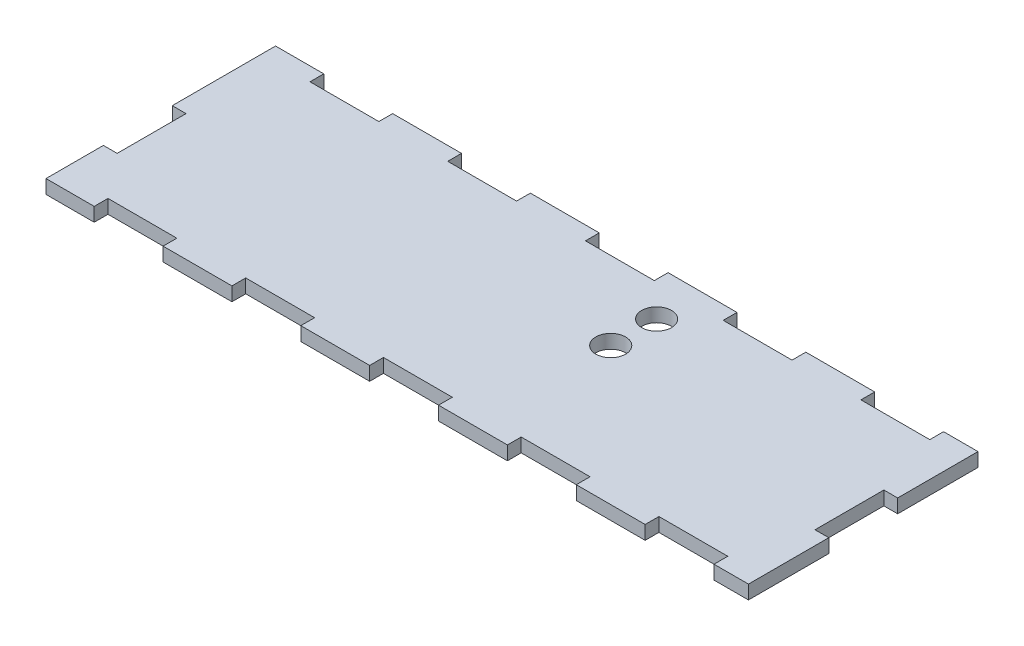
from build123d import *

# Parameters (mm, degrees)
CROQUIS1_R              = 3.25
SALIENTE_EXTRUIR1_DEPTH = 3


with BuildPart() as part:
    # Croquis1 → Saliente-Extruir1 (new body)
    with BuildSketch(Plane(origin=(0, 0, 0), x_dir=(1, 0, 0), z_dir=(0, 1, 0))):
        Polygon((0, 12.5), (0, 0), (10.5, 0), (10.5, 3), (25.5, 3), (25.5, 0), (40.5, 0), (40.5, 3), (55.5, 3), (55.5, 0), (70.5, 0), (70.5, 3), (85.5, 3), (85.5, 0), (100.5, 0), (100.5, 3), (115.5, 3), (115.5, 0), (130.5, 0), (130.5, 3), (145.5, 3), (145.5, 0), (153, 0), (153, 17.5), (150, 17.5), (150, 25), (150, 32.5), (153, 32.5), (153, 50), (145.5, 50), (145.5, 47), (130.5, 47), (130.5, 50), (115.5, 50), (115.5, 47), (100.5, 47), (100.5, 50), (93, 50), (85.5, 50), (85.5, 47), (70.5, 47), (70.5, 50), (67.60876348, 50), (55.5, 50), (55.5, 47), (40.5, 47), (40.5, 50), (25.5, 50), (25.5, 47), (10.5, 47), (10.5, 50), (3, 50), (0, 50), (0, 40), (0, 27.5), (3, 27.5), (3, 20), (3, 12.5), align=None)
        with Locations(Location((93, 30, 0), (0, 0, 270))):
            Circle(CROQUIS1_R, mode=Mode.SUBTRACT)
        with Locations(Location((93, 40, 0), (0, 0, 270))):
            Circle(CROQUIS1_R, mode=Mode.SUBTRACT)
    extrude(amount=SALIENTE_EXTRUIR1_DEPTH)


solid = part.part
